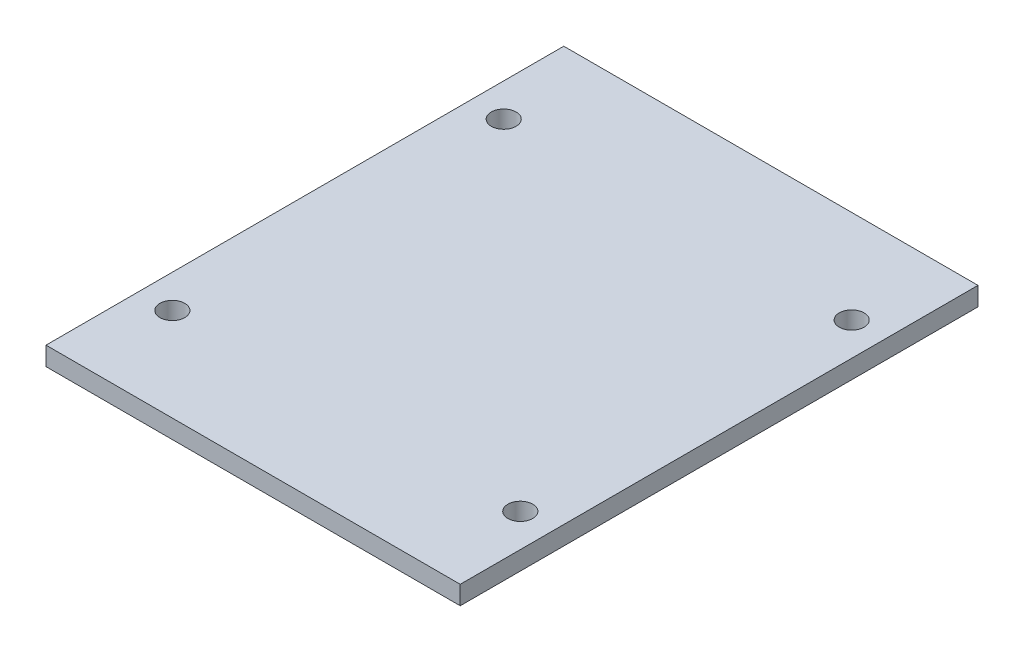
from build123d import *

# Parameters (mm, degrees)
SKETCH1_W           = 200
SKETCH1_H           = 9
BOSS_EXTRUDE1_DEPTH = 250
SKETCH2_R           = 6
CUT_EXTRUDE2_DEPTH  = 321.282687637


with BuildPart() as part:
    # Sketch1 → Boss-Extrude1 (new body)
    with BuildSketch(Plane.XY):
        with Locations((100, -4.5)):
            Rectangle(SKETCH1_W, SKETCH1_H)
    extrude(amount=BOSS_EXTRUDE1_DEPTH)

    # Sketch2 → Cut-Extrude2 (cut, through all)
    with BuildSketch(Plane(origin=(0, 0, 0), x_dir=(1, 0, 0), z_dir=(0, 1, 0))):
        with Locations(Location((16, -45, 0), (0, 0, 270))):
            Circle(SKETCH2_R)
        with Locations(Location((184, -45, 0), (0, 0, 270))):
            Circle(SKETCH2_R)
        with Locations(Location((16, -205, 0), (0, 0, 270))):
            Circle(SKETCH2_R)
        with Locations(Location((184, -205, 0), (0, 0, 270))):
            Circle(SKETCH2_R)
    extrude(amount=-CUT_EXTRUDE2_DEPTH, mode=Mode.SUBTRACT)


solid = part.part
